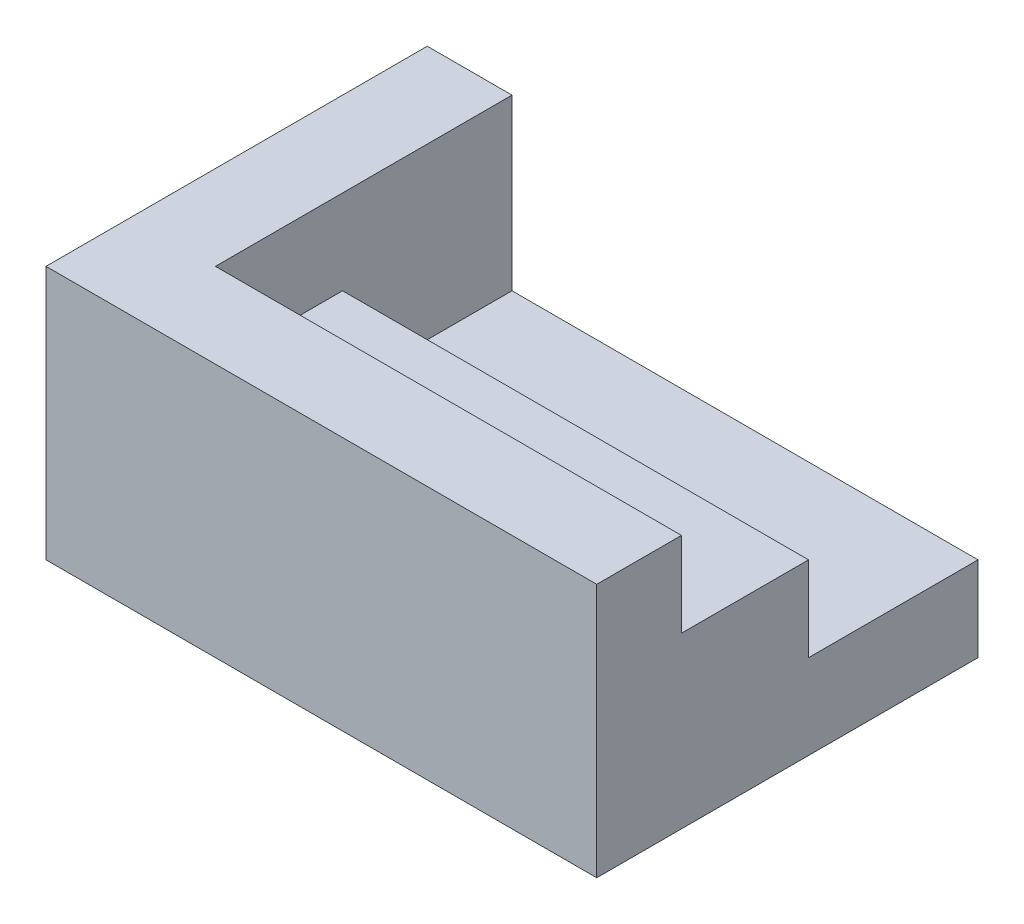
from build123d import *

# Parameters (mm, degrees)
SKETCH1_W           = 104
SKETCH1_H           = 72
BOSS_EXTRUDE1_DEPTH = 16
SKETCH3_W           = 16
SKETCH3_H           = 48
BOSS_EXTRUDE2_DEPTH = 104
SKETCH6_W           = 16
SKETCH6_H           = 48
BOSS_EXTRUDE3_DEPTH = 72
SKETCH7_W           = 88
SKETCH7_H           = 24
BOSS_EXTRUDE4_DEPTH = 16


with BuildPart() as part:
    # Sketch1 → Boss-Extrude1 (new body)
    with BuildSketch(Plane(origin=(0, 0, 0), x_dir=(1, 0, 0), z_dir=(0, 1, 0))):
        with Locations((52, 36)):
            Rectangle(SKETCH1_W, SKETCH1_H)
    extrude(amount=BOSS_EXTRUDE1_DEPTH)

    # Sketch3 → Boss-Extrude2 (add)
    with BuildSketch(Plane.ZY):
        with Locations((-8, 24)):
            Rectangle(SKETCH3_W, SKETCH3_H)
    extrude(amount=-BOSS_EXTRUDE2_DEPTH)

    # Sketch6 → Boss-Extrude3 (add)
    with BuildSketch(Plane(origin=(0, 0, -72), x_dir=(-1, 0, 0), z_dir=(0, 0, -1))):
        with Locations((-8, 24)):
            Rectangle(SKETCH6_W, SKETCH6_H)
    extrude(amount=-BOSS_EXTRUDE3_DEPTH)

    # Sketch7 → Boss-Extrude4 (add)
    with BuildSketch(Plane(origin=(0, 16, 0), x_dir=(1, 0, 0), z_dir=(0, 1, 0))):
        with Locations((60, 28)):
            Rectangle(SKETCH7_W, SKETCH7_H)
    extrude(amount=BOSS_EXTRUDE4_DEPTH)


solid = part.part
